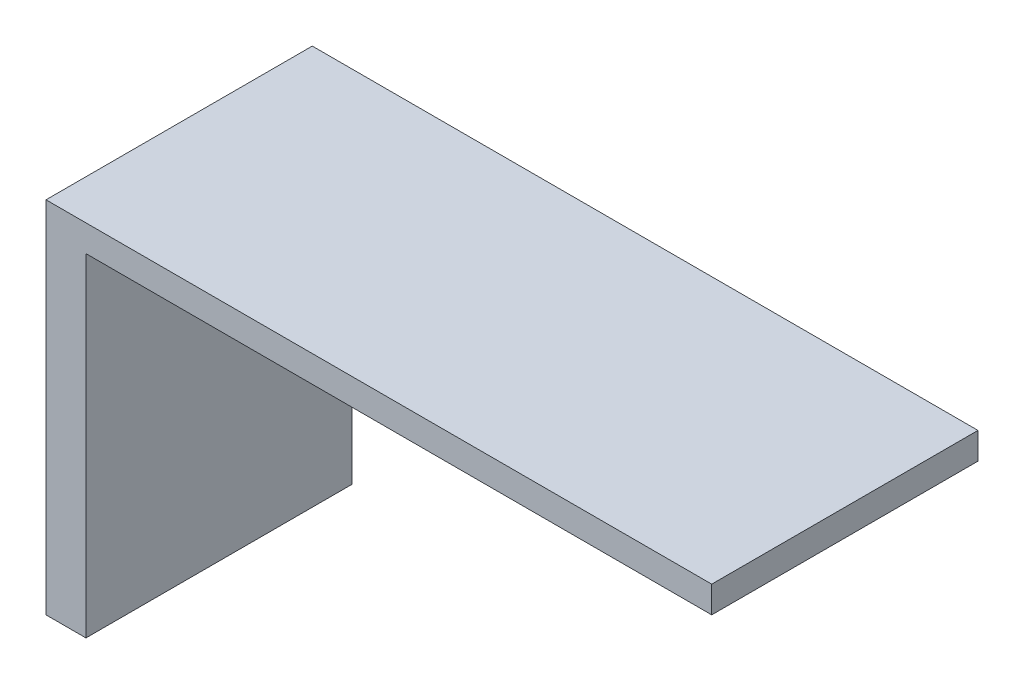
from build123d import *

# Parameters (mm, degrees)
SKETCH1_W           = 50
SKETCH1_H           = 20
BOSS_EXTRUDE1_DEPTH = 2
SKETCH2_W           = 3
SKETCH2_H           = 20
BOSS_EXTRUDE2_DEPTH = 25


with BuildPart() as part:
    # Sketch1 → Boss-Extrude1 (new body)
    with BuildSketch(Plane(origin=(0, 0, 0), x_dir=(1, 0, 0), z_dir=(0, 1, 0))):
        with Locations((25, 10)):
            Rectangle(SKETCH1_W, SKETCH1_H)
    extrude(amount=BOSS_EXTRUDE1_DEPTH)

    # Sketch2 → Boss-Extrude2 (add)
    with BuildSketch(Plane.XZ):
        with Locations((1.5, -10)):
            Rectangle(SKETCH2_W, SKETCH2_H)
    extrude(amount=BOSS_EXTRUDE2_DEPTH)


solid = part.part
